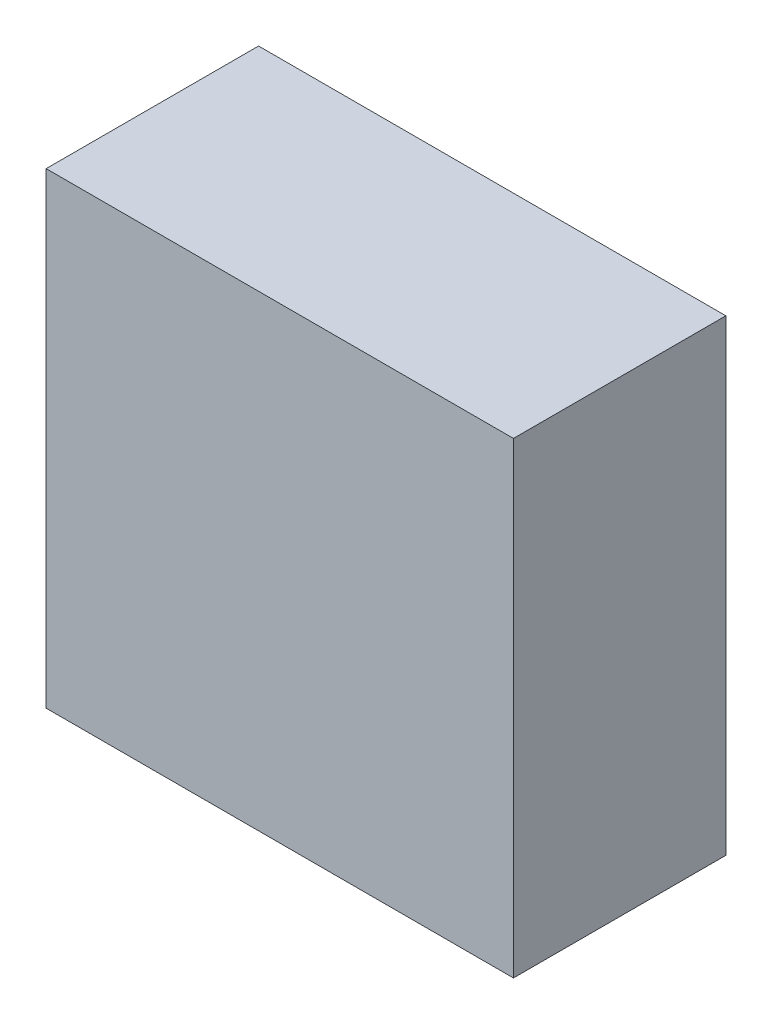
from build123d import *

# Parameters (mm, degrees)
EDRAWING_W     = 11
EDRAWING_H     = 11
EXTRUDE1_DEPTH = 5


with BuildPart() as part:
    # edrawing → extrude1 (new body)
    with BuildSketch(Plane.XY):
        with Locations((5.5, 5.5)):
            Rectangle(EDRAWING_W, EDRAWING_H)
    extrude(amount=EXTRUDE1_DEPTH)


solid = part.part
